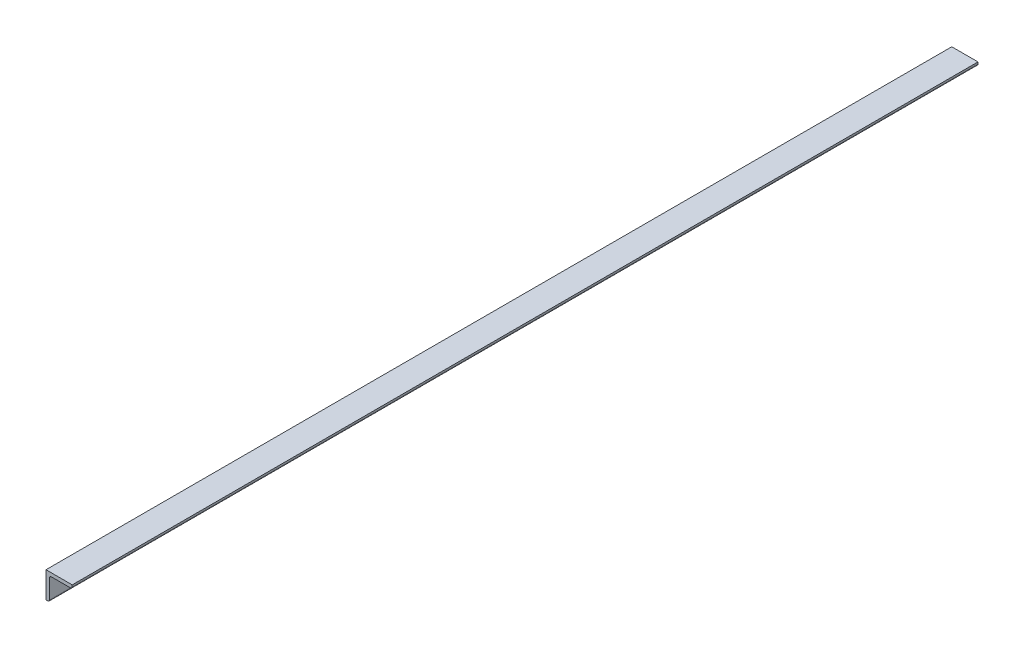
from build123d import *

# Parameters (mm, degrees)
BOSS_EXTRUDE1_DEPTH = 1036


with BuildPart() as part:
    # Sketch1 → Boss-Extrude1 (new body)
    with BuildSketch(Plane.XY):
        with BuildLine():
            Line((-8.625, 38.8125), (-38.625, 38.8125))
            Line((-38.625, 38.8125), (-38.625, 8.8125))
            Line((-38.625, 8.8125), (-36.625, 8.8125))
            ThreePointArc((-36.625, 8.8125), (-35.210786438, 9.398286438), (-34.625, 10.8125))
            Line((-34.625, 10.8125), (-34.625, 32.8125))
            ThreePointArc((-34.625, 32.8125), (-34.039213562, 34.226713562), (-32.625, 34.8125))
            Line((-32.625, 34.8125), (-10.625, 34.8125))
            ThreePointArc((-10.625, 34.8125), (-9.210786438, 35.398286438), (-8.625, 36.8125))
            Line((-8.625, 36.8125), (-8.625, 38.8125))
        make_face()
    extrude(amount=BOSS_EXTRUDE1_DEPTH)


solid = part.part
